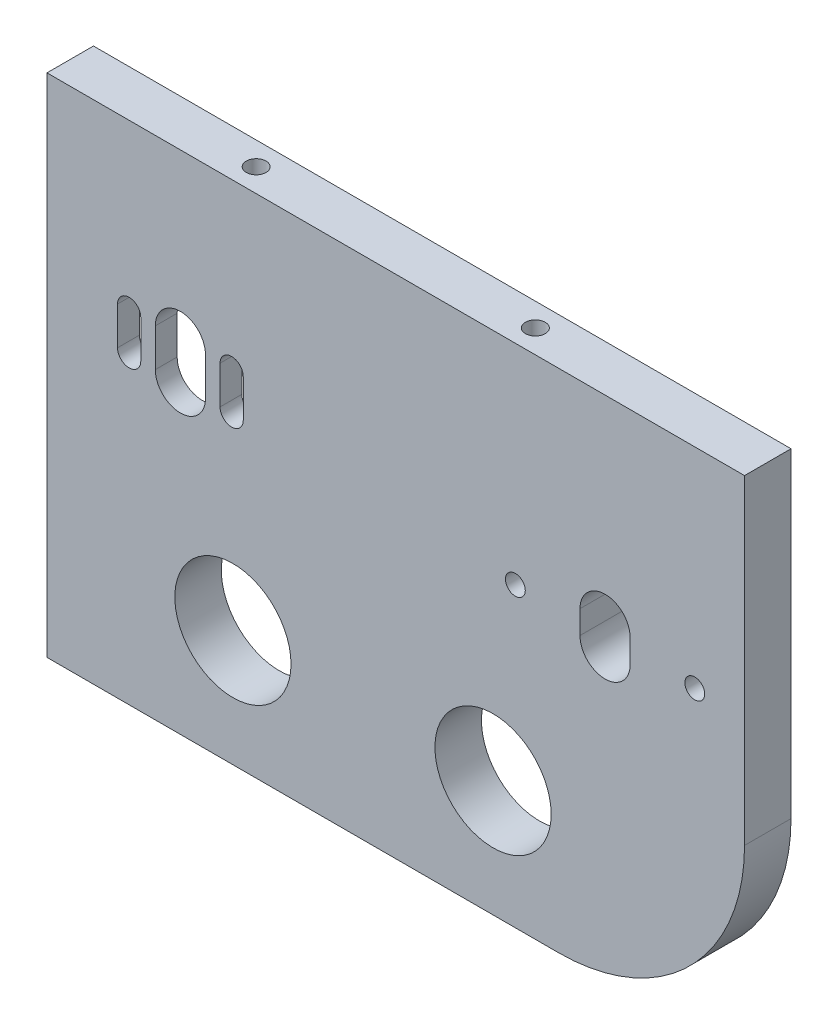
from build123d import *

# Parameters (mm, degrees)
SKETCH1_W                 = 95.287460045
SKETCH1_H                 = 69.153467802
SKETCH1_R                 = 7.9375
BOSS_EXTRUDE1_DEPTH       = 6.35
FILLET1_R                 = 25.4
F_6_32_TAPPED_HOLE1_D     = 2.7051
F_6_32_TAPPED_HOLE1_DEPTH = 10.9728
F_6_32_TAPPED_HOLE1_TIP   = 0.81269403
CUT_EXTRUDE2_DEPTH        = 82.189684793
CUT_EXTRUDE1_DEPTH        = 3.367
F_6_32_TAPPED_HOLE2_D     = 2.7051
F_6_32_TAPPED_HOLE2_DEPTH = 9.398
F_6_32_TAPPED_HOLE2_TIP   = 0.81269403
F_6_32_TAPPED_HOLE3_D     = 2.7051
F_6_32_TAPPED_HOLE3_DEPTH = 9.398
F_6_32_TAPPED_HOLE3_TIP   = 0.81269403


with BuildPart() as part:
    # Sketch1 → Boss-Extrude1 (new body)
    with BuildSketch(Plane.XY.offset(-6.35)):
        with Locations((-13.289407805, 18.701733901)):
            Rectangle(SKETCH1_W, SKETCH1_H)
        with Locations((-35.533137827, 0)):
            Circle(SKETCH1_R, mode=Mode.SUBTRACT)
        Circle(SKETCH1_R, mode=Mode.SUBTRACT)
        with BuildLine():
            Line((11.875322218, 23.115967802), (11.875322218, 26.290967802))
            ThreePointArc((11.875322218, 26.290967802), (15.304322218, 29.719967802), (18.733322218, 26.290967802))
            Line((18.733322218, 26.290967802), (18.733322218, 23.115967802))
            ThreePointArc((18.733322218, 23.115967802), (15.304322218, 19.686967802), (11.875322218, 23.115967802))
        make_face(mode=Mode.SUBTRACT)
    extrude(amount=BOSS_EXTRUDE1_DEPTH)

    # Fillet1
    fillet1_edges = [part.edges().sort_by_distance(p)[0] for p in [
        (34.354322218, -15.875, -3.175),
    ]]
    fillet(fillet1_edges, radius=FILLET1_R)

    # #6-32 Tapped Hole1
    with Locations(Plane(origin=(0, 0, -6.35), x_dir=(-1, 0, 0), z_dir=(0, 0, -1))):
        with Locations((-27.559822218, 24.703467802), (-3.048822218, 24.703467802)):
            Hole(F_6_32_TAPPED_HOLE1_D / 2, depth=F_6_32_TAPPED_HOLE1_DEPTH)
            with Locations((0, 0, -(F_6_32_TAPPED_HOLE1_DEPTH + F_6_32_TAPPED_HOLE1_TIP / 2))):  # 118° drill point
                Cone(0, F_6_32_TAPPED_HOLE1_D / 2, F_6_32_TAPPED_HOLE1_TIP, mode=Mode.SUBTRACT)

    # Sketch4<3> → Cut-Extrude2 (cut, through all)
    with BuildSketch(Plane(origin=(0, 0, -6.35), x_dir=(-1, 0, 0), z_dir=(0, 0, -1))):
        with BuildLine():
            Line((39.282270444, 30.74802952), (39.282270444, 25.573029456))
            ThreePointArc((39.282270444, 25.573029456), (42.707270452, 22.148029448), (46.13227046, 25.573029456))
            Line((46.13227046, 25.573029456), (46.13227046, 30.74802952))
            ThreePointArc((46.13227046, 30.74802952), (42.707270452, 34.173029528), (39.282270444, 30.74802952))
        make_face()
        with BuildLine():
            Line((48.119770452, 30.74802952), (48.119770452, 25.573029456))
            ThreePointArc((48.119770452, 25.573029456), (49.707270452, 23.985529456), (51.294770452, 25.573029456))
            Line((51.294770452, 25.573029456), (51.294770452, 30.74802952))
            ThreePointArc((51.294770452, 30.74802952), (49.707270452, 32.33552952), (48.119770452, 30.74802952))
        make_face()
        with BuildLine():
            Line((37.294770452, 30.74802952), (37.294770452, 25.573029456))
            ThreePointArc((37.294770452, 25.573029456), (35.707270452, 23.985529456), (34.119770452, 25.573029456))
            Line((34.119770452, 25.573029456), (34.119770452, 30.74802952))
            ThreePointArc((34.119770452, 30.74802952), (35.707270452, 32.33552952), (37.294770452, 30.74802952))
        make_face()
    extrude(amount=-CUT_EXTRUDE2_DEPTH, mode=Mode.SUBTRACT)

    # Sketch4 → Cut-Extrude1 (cut)
    with BuildSketch(Plane(origin=(0, 0, -6.35), x_dir=(-1, 0, 0), z_dir=(0, 0, -1))):
        with BuildLine():
            Line((29.607270452, 30.74802952), (29.607270452, 25.573029456))
            ThreePointArc((29.607270452, 25.573029456), (42.707270452, 12.473029456), (55.807270452, 25.573029456))
            Line((55.807270452, 25.573029456), (55.807270452, 30.74802952))
            ThreePointArc((55.807270452, 30.74802952), (42.707270452, 43.84802952), (29.607270452, 30.74802952))
        make_face()
        with BuildLine():
            Line((46.13227046, 30.74802952), (46.13227046, 25.573029456))
            ThreePointArc((46.13227046, 25.573029456), (42.707270452, 22.148029448), (39.282270444, 25.573029456))
            Line((39.282270444, 25.573029456), (39.282270444, 30.74802952))
            ThreePointArc((39.282270444, 30.74802952), (42.707270452, 34.173029528), (46.13227046, 30.74802952))
        make_face(mode=Mode.SUBTRACT)
        with BuildLine():
            Line((34.119770452, 30.74802952), (34.119770452, 25.573029456))
            ThreePointArc((34.119770452, 25.573029456), (35.707270452, 23.985529456), (37.294770452, 25.573029456))
            Line((37.294770452, 25.573029456), (37.294770452, 30.74802952))
            ThreePointArc((37.294770452, 30.74802952), (35.707270452, 32.33552952), (34.119770452, 30.74802952))
        make_face(mode=Mode.SUBTRACT)
        with BuildLine():
            Line((48.119770452, 30.74802952), (48.119770452, 25.573029456))
            ThreePointArc((48.119770452, 25.573029456), (49.707270452, 23.985529456), (51.294770452, 25.573029456))
            Line((51.294770452, 25.573029456), (51.294770452, 30.74802952))
            ThreePointArc((51.294770452, 30.74802952), (49.707270452, 32.33552952), (48.119770452, 30.74802952))
        make_face(mode=Mode.SUBTRACT)
    extrude(amount=-CUT_EXTRUDE1_DEPTH, mode=Mode.SUBTRACT)

    # #6-32 Tapped Hole2
    with Locations(Plane(origin=(0, 53.278467802, 0), x_dir=(1, 0, 0), z_dir=(0, 1, 0))):
        with Locations((-35.533137827, 3.175), (2.604322218, 3.175)):
            Hole(F_6_32_TAPPED_HOLE2_D / 2, depth=F_6_32_TAPPED_HOLE2_DEPTH)
            with Locations((0, 0, -(F_6_32_TAPPED_HOLE2_DEPTH + F_6_32_TAPPED_HOLE2_TIP / 2))):  # 118° drill point
                Cone(0, F_6_32_TAPPED_HOLE2_D / 2, F_6_32_TAPPED_HOLE2_TIP, mode=Mode.SUBTRACT)

    # #6-32 Tapped Hole3
    with Locations(Plane.ZY.offset(60.933137827)):
        with Locations((-3.175, 6.35), (-3.175, 45.340967802)):
            Hole(F_6_32_TAPPED_HOLE3_D / 2, depth=F_6_32_TAPPED_HOLE3_DEPTH)
            with Locations((0, 0, -(F_6_32_TAPPED_HOLE3_DEPTH + F_6_32_TAPPED_HOLE3_TIP / 2))):  # 118° drill point
                Cone(0, F_6_32_TAPPED_HOLE3_D / 2, F_6_32_TAPPED_HOLE3_TIP, mode=Mode.SUBTRACT)


solid = part.part
